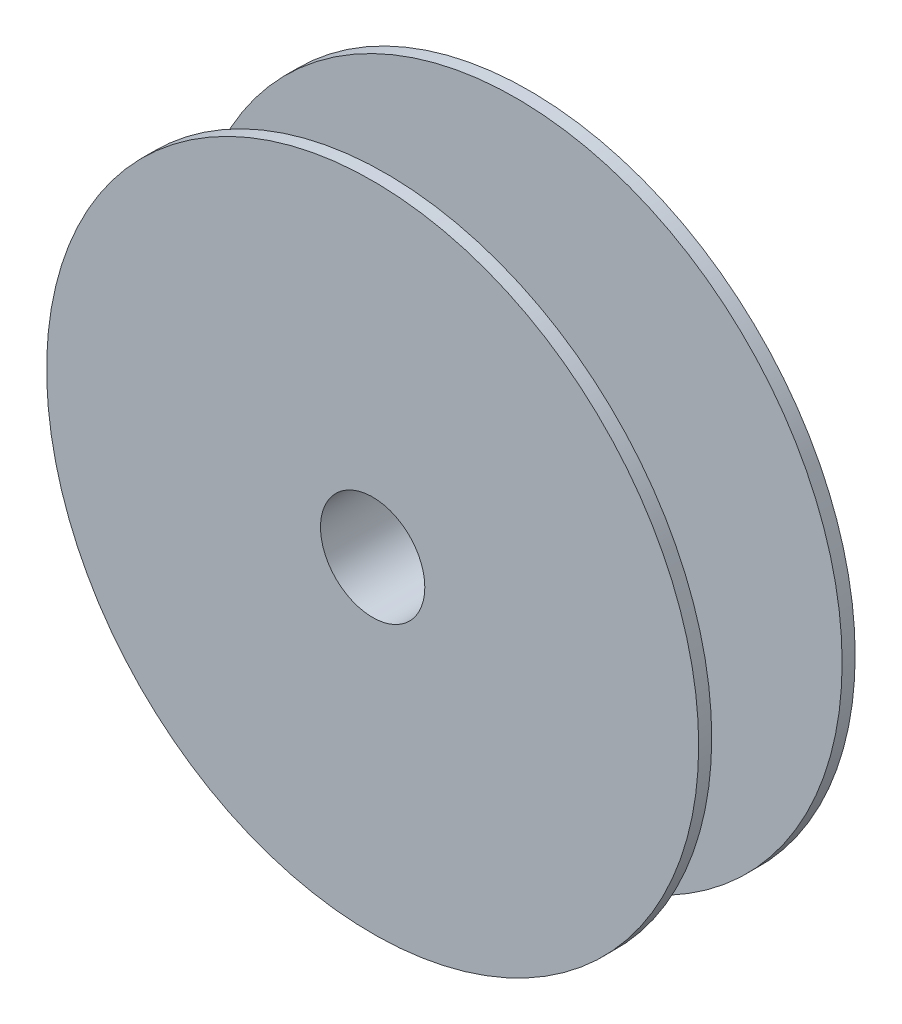
from build123d import *

# Parameters (mm, degrees)
SKETCH1_R           = 125
SKETCH1_R_2         = 20
BOSS_EXTRUDE1_DEPTH = 60
SHELL1_T            = -5


with BuildPart() as part:
    # Sketch1 → Boss-Extrude1 (new body)
    with BuildSketch(Plane.XY):
        Circle(SKETCH1_R)
        Circle(SKETCH1_R_2, mode=Mode.SUBTRACT)
    extrude(amount=BOSS_EXTRUDE1_DEPTH)

    # Shell1
    shell1_openings = [part.faces().sort_by_distance(p)[0] for p in [
        (-125, 0, 30),
    ]]
    offset(amount=SHELL1_T, openings=shell1_openings, kind=Kind.INTERSECTION)


solid = part.part
